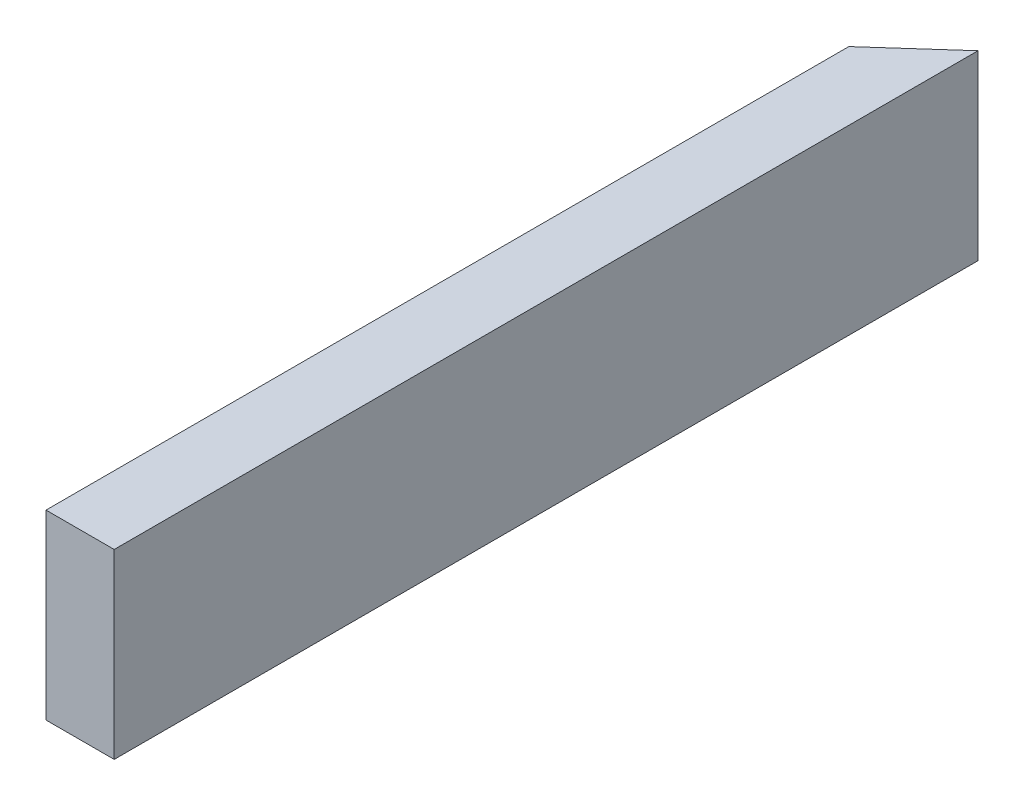
from build123d import *

# Parameters (mm, degrees)
SKETCH1_W           = 3
SKETCH1_H           = 8
BOSS_EXTRUDE1_DEPTH = 38
CUT_EXTRUDE1_DEPTH  = 52


with BuildPart() as part:
    # Sketch1 → Boss-Extrude1 (new body)
    with BuildSketch(Plane.XY):
        with Locations((-2.403225806, 8.838709677)):
            Rectangle(SKETCH1_W, SKETCH1_H)
    extrude(amount=BOSS_EXTRUDE1_DEPTH)

    # Sketch3 → Cut-Extrude1 (cut)
    with BuildSketch(Plane(origin=(0, 12.838709677, 0), x_dir=(1, 0, 0), z_dir=(0, 1, 0))):
        Polygon((-0.903225806, 0), (-3.903225806, -2.682309573), (-3.903225806, 0), align=None)
    extrude(amount=-CUT_EXTRUDE1_DEPTH, mode=Mode.SUBTRACT)


solid = part.part
